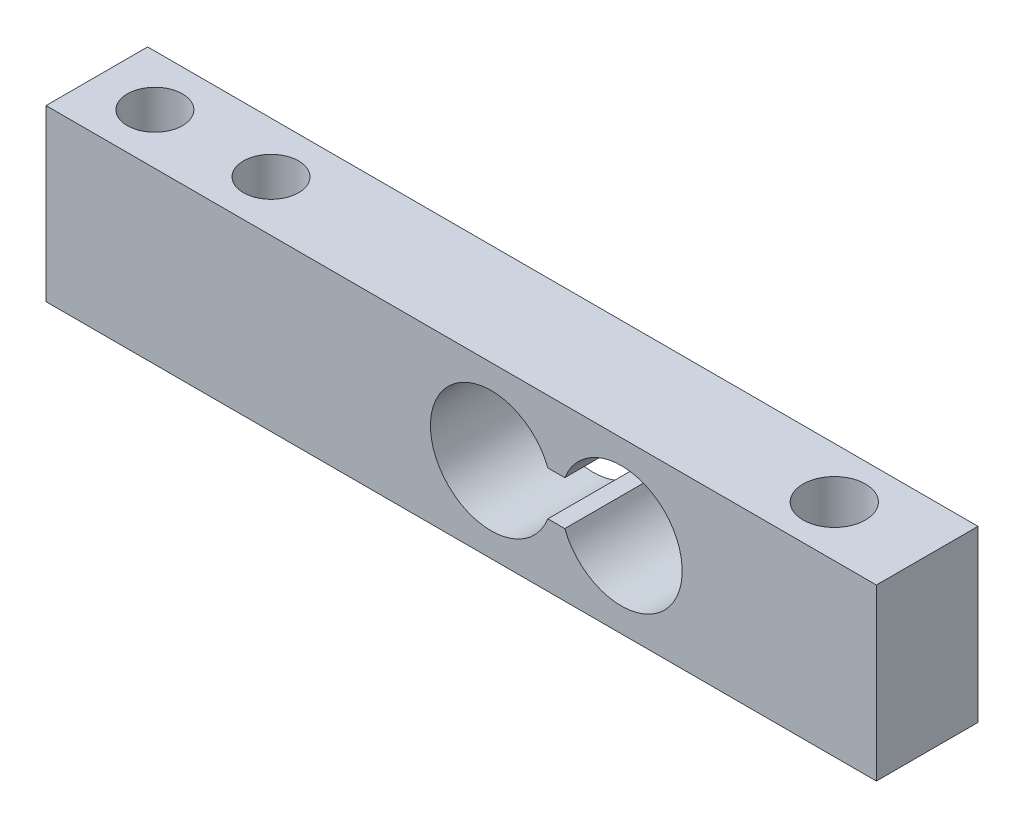
from build123d import *

# Parameters (mm, degrees)
SKETCH1_W               = 57.2
SKETCH1_H               = 11.7
BOSS_EXTRUDE1_DEPTH     = 7
CUT_EXTRUDE1_DEPTH      = 59.802465935
CUT_EXTRUDE1_DEPTH_BACK = 59.802465935
SKETCH2_R               = 2.15
SKETCH2_R_2             = 1.9
CUT_EXTRUDE2_DEPTH      = 59.802465935


with BuildPart() as part:
    # Sketch1 → Boss-Extrude1 (new body)
    with BuildSketch(Plane.XY):
        with Locations((28.6, 5.85)):
            Rectangle(SKETCH1_W, SKETCH1_H)
    extrude(amount=BOSS_EXTRUDE1_DEPTH)

    # Sketch2 → Cut-Extrude1 (cut, two sides: drawn at the far end of the back side and taken through both)
    with BuildSketch(Plane(origin=(0, 11.7, 0), x_dir=(1, 0, 0), z_dir=(0, 1, 0)).offset(-CUT_EXTRUDE1_DEPTH_BACK)):
        with Locations(Location((50.8, -3.5, 0), (0, 0, 270))):
            Circle(SKETCH2_R)
        with Locations(Location((4, -3.5, 0), (0, 0, 270))):
            Circle(SKETCH2_R_2)
        with Locations(Location((12, -3.5, 0), (0, 0, 270))):
            Circle(SKETCH2_R_2)
    extrude(amount=CUT_EXTRUDE1_DEPTH + CUT_EXTRUDE1_DEPTH_BACK, mode=Mode.SUBTRACT)

    # Sketch3 → Cut-Extrude2 (cut, through all)
    with BuildSketch(Plane.XY.offset(7)):
        with BuildLine():
            Line((34.57071198, 7.367429549), (35.734206681, 7.367429549))
            ThreePointArc((35.734206681, 7.367429549), (43.82348168, 5.85), (35.734206681, 4.332570451))
            Line((35.734206681, 4.332570451), (34.57071198, 4.332570451))
            ThreePointArc((34.57071198, 4.332570451), (26.48143698, 5.85), (34.57071198, 7.367429549))
        make_face()
    extrude(amount=-CUT_EXTRUDE2_DEPTH, mode=Mode.SUBTRACT)


solid = part.part
